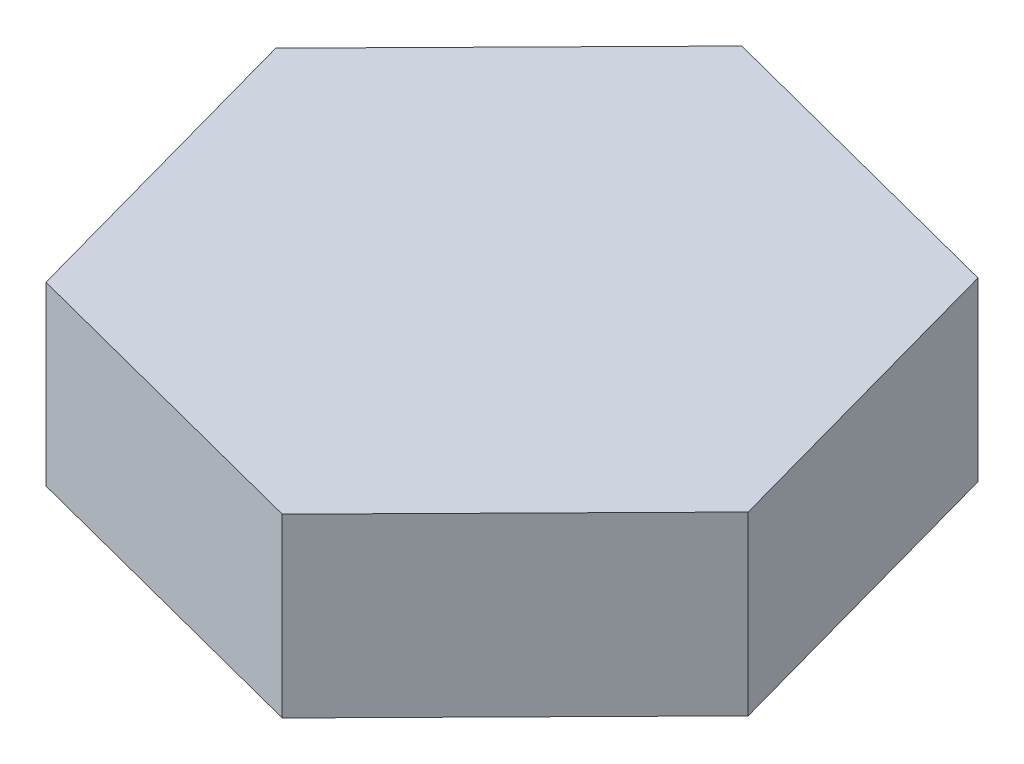
from build123d import *

# Parameters (mm, degrees)
BOSS_EXTRUDE1_DEPTH = 3


with BuildPart() as part:
    # Sketch1 → Boss-Extrude1 (new body)
    with BuildSketch(Plane(origin=(0, 0, 0), x_dir=(1, 0, 0), z_dir=(0, 1, 0))):
        Polygon((27.562361435, 0.976166967), (31.490364746, 4.967923889), (29.997403502, 10.365553004), (24.576438946, 11.771425196), (20.648435635, 7.779668275), (22.14139688, 2.38203916), align=None)
    extrude(amount=BOSS_EXTRUDE1_DEPTH)


solid = part.part
